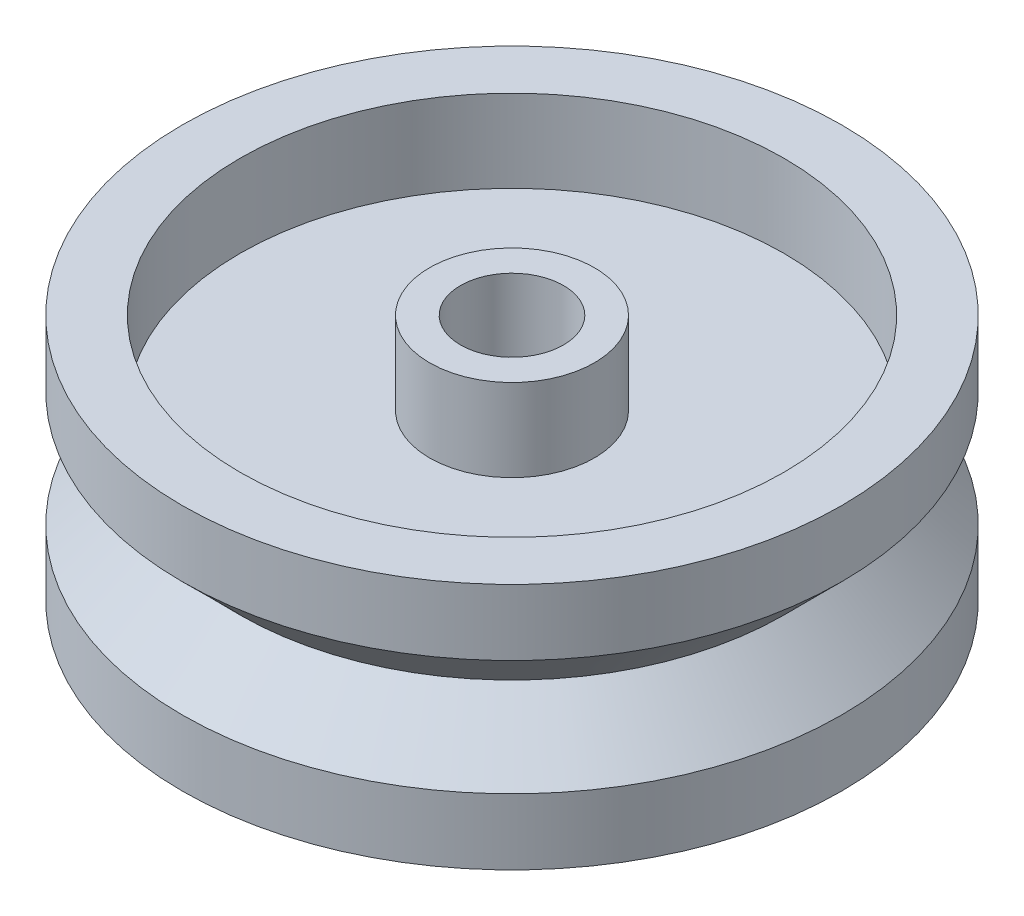
from build123d import *

# Parameters (mm, degrees)
BOSS_EXTRUDE1_DEPTH        = 7.5
BOSS_EXTRUDE1_DEPTH_BACK   = 7.5
SKETCH1_R                  = 5
SKETCH1_R_2                = 3.125
BOSS_EXTRUDE1_2_DEPTH      = 7.5
BOSS_EXTRUDE1_2_DEPTH_BACK = 7.5
SKETCH1_R_3                = 20
SKETCH1_R_4                = 16.5
BOSS_EXTRUDE2_DEPTH        = 2.5
BOSS_EXTRUDE2_DEPTH_BACK   = 2.5
SKETCH1_3_R                = 16.5
SKETCH1_3_R_2              = 5


with BuildPart() as part:
    # Sketch1 → Boss-Extrude1 (new, two sides: drawn at the far end of the back side and taken through both)
    with BuildSketch(Plane(origin=(0, 0, 0), x_dir=(-1, 0, 0), z_dir=(0, 1, 0)).offset(-BOSS_EXTRUDE1_DEPTH_BACK)):
        Circle(SKETCH1_R)
        Circle(SKETCH1_R_2, mode=Mode.SUBTRACT)
    extrude(amount=BOSS_EXTRUDE1_DEPTH + BOSS_EXTRUDE1_DEPTH_BACK)



with BuildPart() as body_2:
    # Sketch1 → Boss-Extrude1 2 (new, two sides: drawn at the far end of the back side and taken through both)
    with BuildSketch(Plane(origin=(0, 0, 0), x_dir=(-1, 0, 0), z_dir=(0, 1, 0)).offset(-BOSS_EXTRUDE1_2_DEPTH_BACK)):
        Circle(SKETCH1_R_3)
        Circle(SKETCH1_R_4, mode=Mode.SUBTRACT)
    extrude(amount=BOSS_EXTRUDE1_2_DEPTH + BOSS_EXTRUDE1_2_DEPTH_BACK)


with BuildPart() as part_1:
    add(part.part)

    add(body_2.part)  # Boss-Extrude2 merges body 2
    # Sketch1<3> → Boss-Extrude2 (add, two sides: drawn at the far end of the back side and taken through both)
    with BuildSketch(Plane(origin=(0, 0, 0), x_dir=(-1, 0, 0), z_dir=(0, 1, 0)).offset(-BOSS_EXTRUDE2_DEPTH_BACK)):
        Circle(SKETCH1_3_R)
        Circle(SKETCH1_3_R_2, mode=Mode.SUBTRACT)
    extrude(amount=BOSS_EXTRUDE2_DEPTH + BOSS_EXTRUDE2_DEPTH_BACK)

    # Sketch2 → Cut-Revolve1 (revolve, cut)
    with BuildSketch(Plane(origin=(0, 0, 0), x_dir=(0, 1, 0), z_dir=(0, 0, 1))):
        Polygon((3.5, 20), (0, 16.5), (-3.5, 20), align=None)
        Polygon((-3.5, -20), (3.5, -20), (0, -16.5), align=None)
    revolve(axis=Axis((0, -9.980216616, 0), (0, 1, 0)), mode=Mode.SUBTRACT)


solid = part_1.part
